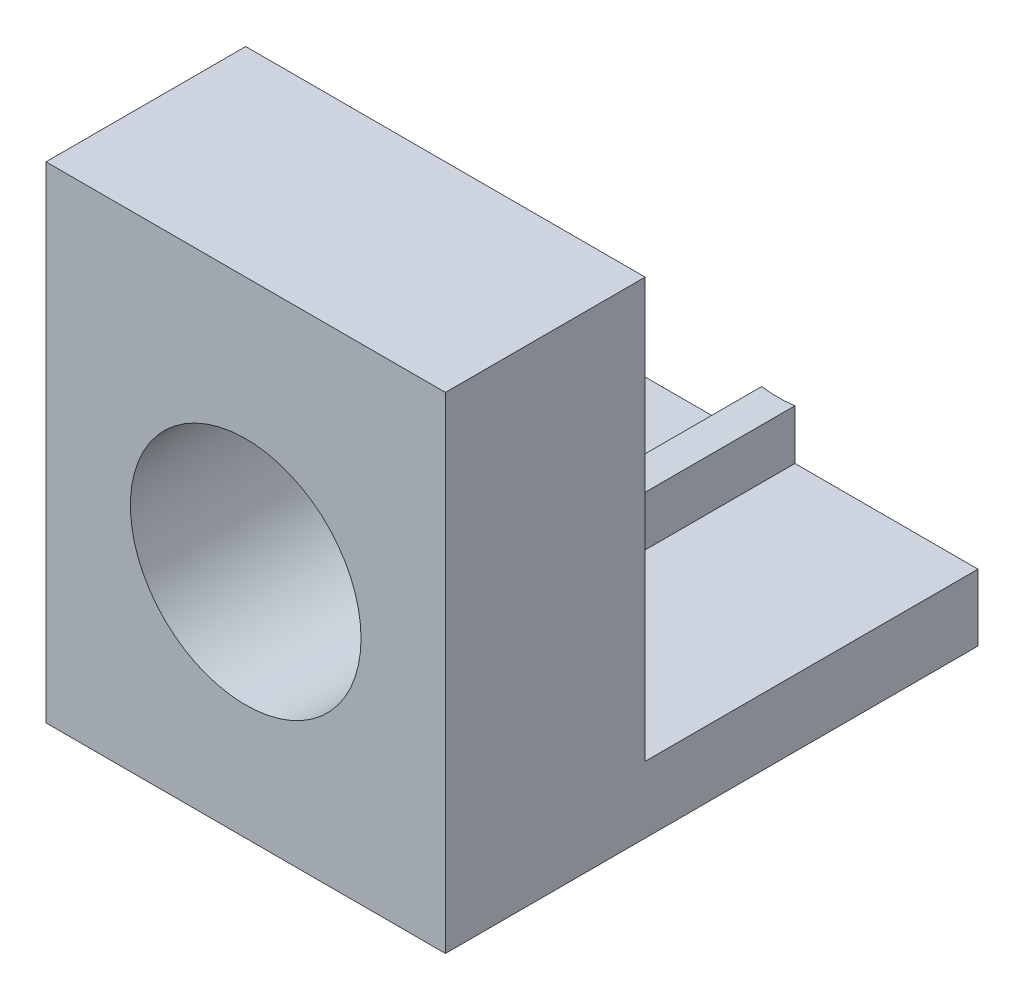
from build123d import *

# Parameters (mm, degrees)
SKETCH1_W           = 38.1
SKETCH1_H           = 50.8
BOSS_EXTRUDE1_DEPTH = 6.35
SKETCH2_W           = 3.175
SKETCH2_H           = 50.8
BOSS_EXTRUDE2_DEPTH = 6.35
SKETCH3_W           = 38.1
SKETCH3_H           = 19.05
BOSS_EXTRUDE3_DEPTH = 40
SKETCH4_R           = 11
CUT_EXTRUDE1_DEPTH  = 72.357305162


with BuildPart() as part:
    # Sketch1 → Boss-Extrude1 (new body)
    with BuildSketch(Plane(origin=(0, 0, 0), x_dir=(1, 0, 0), z_dir=(0, 1, 0))):
        Rectangle(SKETCH1_W, SKETCH1_H)
    extrude(amount=BOSS_EXTRUDE1_DEPTH)

    # Sketch2 → Boss-Extrude2 (add)
    with BuildSketch(Plane(origin=(0, 6.35, 0), x_dir=(1, 0, 0), z_dir=(0, 1, 0))):
        Rectangle(SKETCH2_W, SKETCH2_H)
    extrude(amount=BOSS_EXTRUDE2_DEPTH)

    # Sketch3 → Boss-Extrude3 (add)
    with BuildSketch(Plane(origin=(0, 6.35, 0), x_dir=(1, 0, 0), z_dir=(0, 1, 0))):
        with Locations((0, -15.875)):
            Rectangle(SKETCH3_W, SKETCH3_H)
    extrude(amount=BOSS_EXTRUDE3_DEPTH)

    # Sketch4 → Cut-Extrude1 (cut, through all)
    with BuildSketch(Plane.XY.offset(25.4)):
        with Locations((0, 22)):
            Circle(SKETCH4_R)
    extrude(amount=-CUT_EXTRUDE1_DEPTH, mode=Mode.SUBTRACT)


solid = part.part
